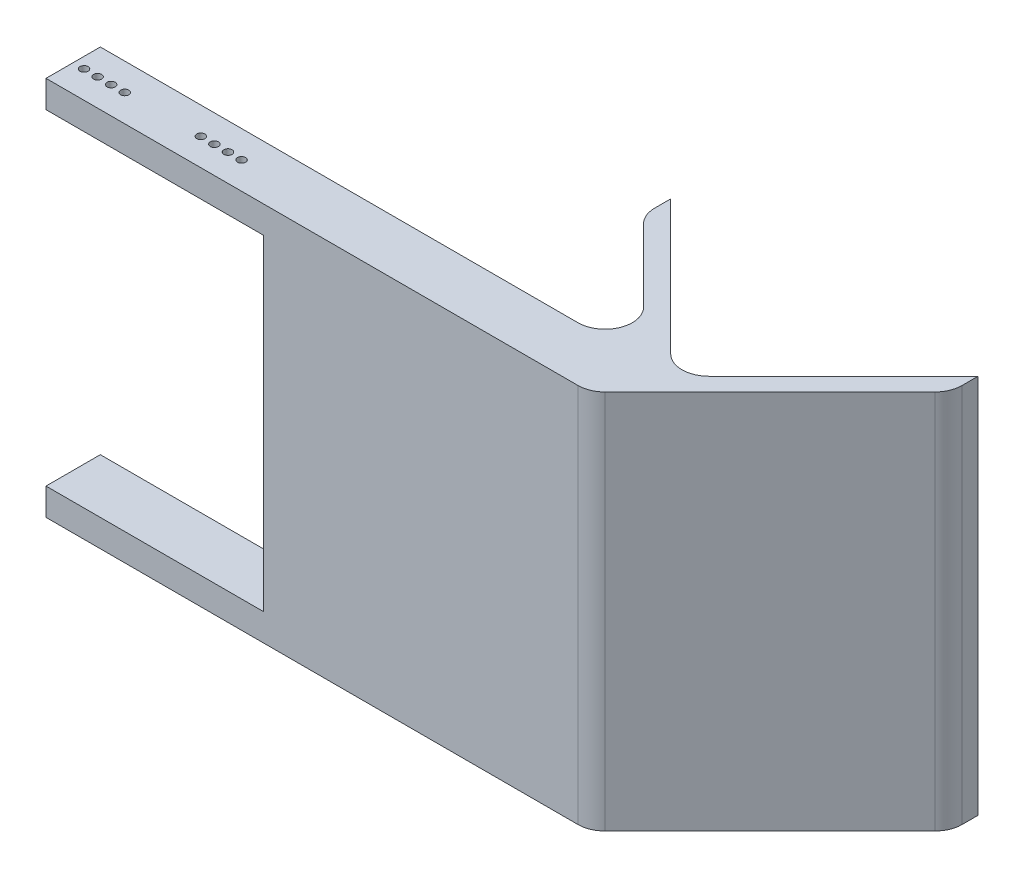
from build123d import *

# Parameters (mm, degrees)
BOSS_EXTRUDE3_DEPTH     = 70
FILLET7_R               = 5
FILLET8_R               = 5
FILLET9_R               = 5
FILLET10_R              = 5
ESQUISSE3_W             = 30
ESQUISSE3_H             = 60
ENL_V_MAT_EXTRU_1_DEPTH = 107.418983269
ESQUISSE5_W             = 10
ESQUISSE5_H             = 60
ENL_V_MAT_EXTRU_2_DEPTH = 107.418983269
ESQUISSE13_R            = 0.75
ENL_V_MAT_EXTRU_3_DEPTH = 10
ESQUISSE4_R             = 0.75
ENL_V_MAT_EXTRU_6_DEPTH = 10


with BuildPart() as part:
    # Sketch1 → Boss-Extrude3 (new body)
    with BuildSketch(Plane(origin=(0, 0, 0), x_dir=(1, 0, 0), z_dir=(0, 1, 0))):
        Polygon((-75, 0), (-75, 10), (25, 10), (1.715728753, 33.284271247), (1.715728753, 38.284271247), (30, 10), (58.284271247, 38.284271247), (58.284271247, 33.284271247), (35, 10), (25, 0), align=None)
    extrude(amount=BOSS_EXTRUDE3_DEPTH)

    # Fillet7
    fillet7_edges = [part.edges().sort_by_distance(p)[0] for p in [
        (30, 35, -10),
    ]]
    fillet(fillet7_edges, radius=FILLET7_R)

    # Fillet8
    fillet8_edges = [part.edges().sort_by_distance(p)[0] for p in [
        (25, 35, -10),
    ]]
    fillet(fillet8_edges, radius=FILLET8_R)

    # Fillet9
    fillet9_edges = [part.edges().sort_by_distance(p)[0] for p in [
        (58.284271247, 35, -33.284271247),
        (1.715728753, 35, -33.284271247),
    ]]
    fillet(fillet9_edges, radius=FILLET9_R)

    # Fillet10
    fillet10_edges = [part.edges().sort_by_distance(p)[0] for p in [
        (25, 35, 0),
    ]]
    fillet(fillet10_edges, radius=FILLET10_R)

    # Esquisse3 → Enlèv. mat.-Extru.1 (cut, through all)
    with BuildSketch(Plane(origin=(0, 0, -10), x_dir=(-1, 0, 0), z_dir=(0, 0, -1))):
        with Locations((60, 35)):
            Rectangle(ESQUISSE3_W, ESQUISSE3_H)
    extrude(amount=-ENL_V_MAT_EXTRU_1_DEPTH, mode=Mode.SUBTRACT)

    # Esquisse5 → Enlèv. mat.-Extru.2 (cut, through all)
    with BuildSketch(Plane(origin=(0, 0, -10), x_dir=(-1, 0, 0), z_dir=(0, 0, -1))):
        with Locations((40, 35)):
            Rectangle(ESQUISSE5_W, ESQUISSE5_H)
    extrude(amount=-ENL_V_MAT_EXTRU_2_DEPTH, mode=Mode.SUBTRACT)

    # Esquisse13 → Enlèv. mat.-Extru.3 (cut)
    with BuildSketch(Plane(origin=(0, 65, 0), x_dir=(-1, 0, 0), z_dir=(0, -1, 0))):
        with Locations(Location((44, 5, 0), (0, 0, 90))):
            Circle(ESQUISSE13_R)
    extrude(amount=-ENL_V_MAT_EXTRU_3_DEPTH, mode=Mode.SUBTRACT)

    # Esquisse4 → Enlèv. mat.-Extru.6 (cut)
    with BuildSketch(Plane.XZ.offset(-65)):
        with Locations((-73, -5)):
            Circle(ESQUISSE4_R)
        with Locations((-68, -5)):
            Circle(ESQUISSE4_R)
        with Locations((-70.5, -5)):
            Circle(ESQUISSE4_R)
        with Locations((-65.5, -5)):
            Circle(ESQUISSE4_R)
        with Locations((-46.5, -5)):
            Circle(ESQUISSE4_R)
        with Locations((-49, -5)):
            Circle(ESQUISSE4_R)
        with Locations((-51.5, -5)):
            Circle(ESQUISSE4_R)
    extrude(amount=-ENL_V_MAT_EXTRU_6_DEPTH, mode=Mode.SUBTRACT)


solid = part.part
